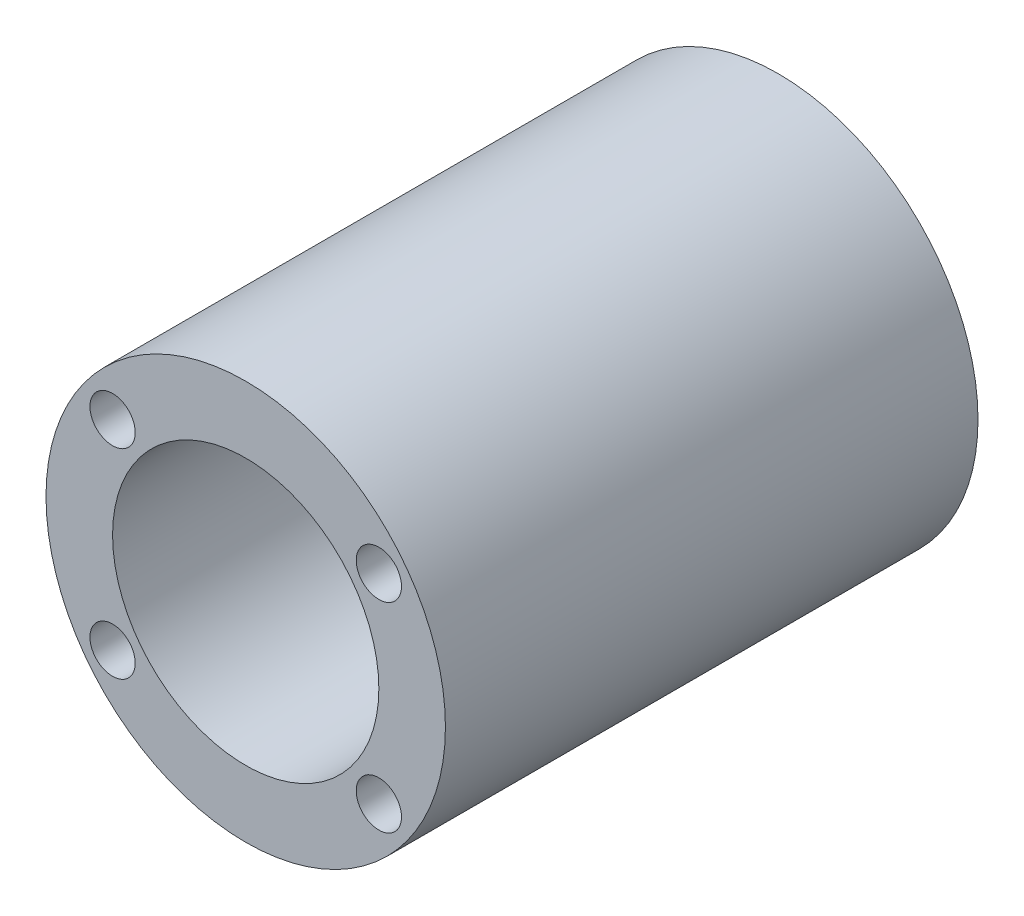
from build123d import *

# Parameters (mm, degrees)
SKETCH1_R                             = 30
SKETCH1_R_2                           = 20
BOSS_EXTRUDE1_DEPTH                   = 40
TAP_DRILL_FOR_M8X1_25_TAP1_AT_2_COUNT = 2
TAP_DRILL_FOR_M8X1_25_TAP1_AT_2_PITCH = 40
TAP_DRILL_FOR_M8X1_25_TAP1_AT_3_COUNT = 2
TAP_DRILL_FOR_M8X1_25_TAP1_AT_3_PITCH = 50
TAP_DRILL_FOR_M8X1_25_TAP1_AT_4_COUNT = 2
TAP_DRILL_FOR_M8X1_25_TAP1_AT_4_PITCH = 30


with BuildPart() as part:
    # Sketch1 → Boss-Extrude1 (new, symmetric)
    with BuildSketch(Plane.XY):
        Circle(SKETCH1_R)
        Circle(SKETCH1_R_2, mode=Mode.SUBTRACT)
    extrude(amount=BOSS_EXTRUDE1_DEPTH, both=True)

    # Sketch12 → Tap Drill for M8x1.25 Tap1 (revolve, cut)
    with BuildSketch(Plane(origin=(-20, 15, 40), x_dir=(0, -1, 0), z_dir=(1, 0, 0))):
        Polygon((0, 0), (0, 22.042926105), (3.4, 20), (3.4, 0), align=None)
    tap_drill_for_m8x1_25_tap1 = revolve(axis=Axis((-20, 15, 46.35), (0, 0, -1)), mode=Mode.SUBTRACT)

    # Tap Drill for M8x1.25 Tap1 at 2: Tap Drill for M8x1.25 Tap1 ×2
    with Locations(*[(i * TAP_DRILL_FOR_M8X1_25_TAP1_AT_2_PITCH, 0, 0) for i in range(1, TAP_DRILL_FOR_M8X1_25_TAP1_AT_2_COUNT)]):
        add(tap_drill_for_m8x1_25_tap1, mode=Mode.SUBTRACT)

    # Tap Drill for M8x1.25 Tap1 at 3: Tap Drill for M8x1.25 Tap1 ×2
    with Locations(*[Vector(0.7999999999999999, -0.6000000000000001, 0) * (i * TAP_DRILL_FOR_M8X1_25_TAP1_AT_3_PITCH) for i in range(1, TAP_DRILL_FOR_M8X1_25_TAP1_AT_3_COUNT)]):
        add(tap_drill_for_m8x1_25_tap1, mode=Mode.SUBTRACT)

    # Tap Drill for M8x1.25 Tap1 at 4: Tap Drill for M8x1.25 Tap1 ×2
    with Locations(*[(0, -i * TAP_DRILL_FOR_M8X1_25_TAP1_AT_4_PITCH, 0) for i in range(1, TAP_DRILL_FOR_M8X1_25_TAP1_AT_4_COUNT)]):
        add(tap_drill_for_m8x1_25_tap1, mode=Mode.SUBTRACT)

    # Mirror1: Tap Drill for M8x1.25 Tap1 across plane
    add(tap_drill_for_m8x1_25_tap1.mirror(Plane.XY), mode=Mode.SUBTRACT)

    # Mirror1 copy 1 sketch → Mirror1 copy 1 (revolve, cut)
    with BuildSketch(Plane(origin=(20, 15, -40), x_dir=(0, -1, 0), z_dir=(1, 0, 0))):
        Polygon((0, 0), (0, -22.042926105), (3.4, -20), (3.4, 0), align=None)
    revolve(axis=Axis((20, 15, -46.35), (0, 0, -1)), mode=Mode.SUBTRACT)

    # Mirror1 copy 2 sketch → Mirror1 copy 2 (revolve, cut)
    with BuildSketch(Plane(origin=(20, -15, -40), x_dir=(0, -1, 0), z_dir=(1, 0, 0))):
        Polygon((0, 0), (0, -22.042926105), (3.4, -20), (3.4, 0), align=None)
    revolve(axis=Axis((20, -15, -46.35), (0, 0, -1)), mode=Mode.SUBTRACT)

    # Mirror1 copy 3 sketch → Mirror1 copy 3 (revolve, cut)
    with BuildSketch(Plane(origin=(-20, -15, -40), x_dir=(0, -1, 0), z_dir=(1, 0, 0))):
        Polygon((0, 0), (0, -22.042926105), (3.4, -20), (3.4, 0), align=None)
    revolve(axis=Axis((-20, -15, -46.35), (0, 0, -1)), mode=Mode.SUBTRACT)


solid = part.part
